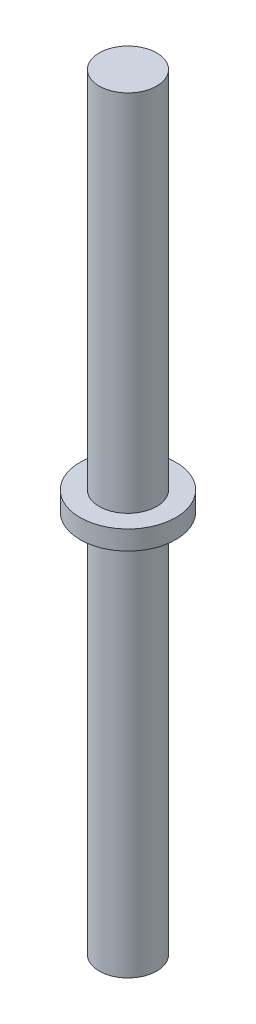
from build123d import *

# Parameters (mm, degrees)
SKETCH1_R           = 7.5
BOSS_EXTRUDE1_DEPTH = 200
BOSS_EXTRUDE2_START = -100
SKETCH2_R           = 12.5
BOSS_EXTRUDE2_DEPTH = 5


with BuildPart() as part:
    # Sketch1 → Boss-Extrude1 (new body)
    with BuildSketch(Plane(origin=(0, 0, 0), x_dir=(1, 0, 0), z_dir=(0, 1, 0))):
        with Locations(Location((0, 0, 0), (0, 0, 270))):
            Circle(SKETCH1_R)
    extrude(amount=BOSS_EXTRUDE1_DEPTH)

    # Sketch2 → Boss-Extrude2 (add)
    with BuildSketch(Plane(origin=(0, 200, 0), x_dir=(1, 0, 0), z_dir=(0, 1, 0)).offset(BOSS_EXTRUDE2_START)):
        with Locations(Location((0, 0, 0), (0, 0, 270))):
            Circle(SKETCH2_R)
    extrude(amount=BOSS_EXTRUDE2_DEPTH)


solid = part.part
